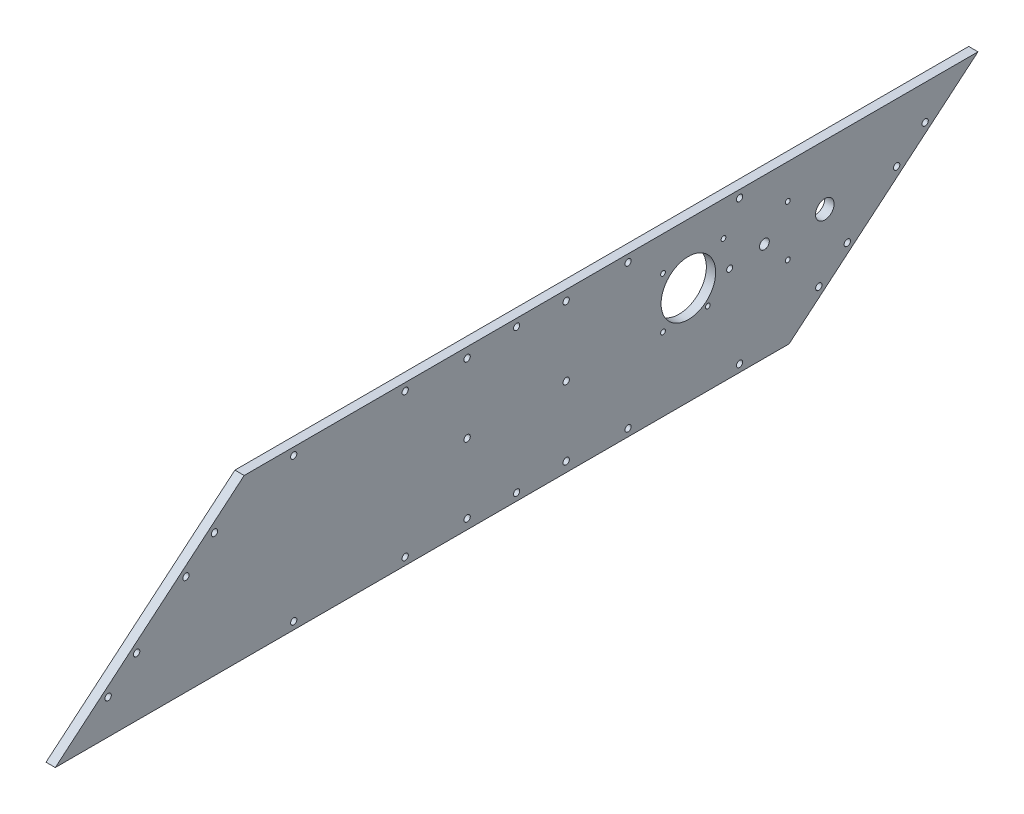
from build123d import *

# Parameters (mm, degrees)
BOSS_EXTRUDE1_DEPTH          = 4.7625
SKETCH2_R                    = 2.5
SKETCH2_R_2                  = 1.51
SKETCH2_R_3                  = 14
SKETCH2_R_4                  = 4.7625
GEARBOX_WITH_SLIP_FITS_DEPTH = 412.602247496
SKETCH5_R                    = 1.59385
CUT_EXTRUDE1_DEPTH           = 412.602247496
F_2_CLEARANCE_HOLE1_D        = 2.4384
F_4_CLEARANCE_HOLE2_D        = 3.2639
F_4_CLEARANCE_HOLE1_D        = 3.2639
F_4_CLEARANCE_HOLE1_DEPTH    = 4.826
F_4_CLEARANCE_HOLE1_TIP      = 0.980574487


with BuildPart() as part:
    # Sketch1 → Boss-Extrude1 (new body)
    with BuildSketch(Plane(origin=(0, 0, 0), x_dir=(0, 0, -1), z_dir=(1, 0, 0))):
        Polygon((33.297595377, -40.64), (312.697595377, -40.64), (345.995190754, -12.7), (409.563327383, 40.64), (312.697595377, 40.64), (33.297595377, 40.64), (0, 12.7), (-63.568136629, -40.64), align=None)
    extrude(amount=BOSS_EXTRUDE1_DEPTH)

    # Sketch2 → Gearbox (with Slip fits) (cut, through all)
    with BuildSketch(Plane(origin=(4.7625, 0, 0), x_dir=(0, 0, -1), z_dir=(1, 0, 0))):
        with Locations((300.047997385, 10.000000066)):
            Circle(SKETCH2_R)
        with Locations((282.21469668, 8.000000066)):
            Circle(SKETCH2_R_2)
        with Locations((261.047997385, 10.000000066)):
            Circle(SKETCH2_R_3)
        with Locations((331.004197385, 10.000000066)):
            Circle(SKETCH2_R_4)
    extrude(amount=-GEARBOX_WITH_SLIP_FITS_DEPTH, mode=Mode.SUBTRACT)

    # Sketch5 → Cut-Extrude1 (cut, through all)
    with BuildSketch(Plane(origin=(4.7625, 0, 0), x_dir=(0, 0, -1), z_dir=(1, 0, 0))):
        with Locations((287.297595377, 36.83)):
            Circle(SKETCH5_R)
        with Locations((230.147595377, 36.83)):
            Circle(SKETCH5_R)
        with Locations((172.997595377, 36.83)):
            Circle(SKETCH5_R)
        with Locations((115.847595377, 36.83)):
            Circle(SKETCH5_R)
        with Locations((58.697595377, 36.83)):
            Circle(SKETCH5_R)
        with Locations((58.697595377, -36.83)):
            Circle(SKETCH5_R)
        with Locations((115.847595377, -36.83)):
            Circle(SKETCH5_R)
        with Locations((172.997595377, -36.83)):
            Circle(SKETCH5_R)
        with Locations((230.147595377, -36.83)):
            Circle(SKETCH5_R)
        with Locations((287.297595377, -36.83)):
            Circle(SKETCH5_R)
    extrude(amount=-CUT_EXTRUDE1_DEPTH, mode=Mode.SUBTRACT)

    # #2 Clearance Hole1 (through all)
    with Locations(Plane(origin=(4.7625, 0, 0), x_dir=(0, 0, -1), z_dir=(1, 0, 0))):
        with Locations((248.047997385, 23.000000066), (279.047997385, 23.000000066), (271.047997455, -2.999999934), (248.047997385, -2.999999934), (312.047997385, 23.000000066), (312.047997385, -2.999999934)):
            Hole(F_2_CLEARANCE_HOLE1_D / 2)

    # #4 Clearance Hole2 (through all)
    with Locations(Plane(origin=(4.7625, 0, 0), x_dir=(0, 0, -1), z_dir=(1, 0, 0))):
        with Locations((147.597595377, 35.56), (198.397595377, 35.56), (198.397595377, -35.56), (147.597595377, -35.56), (147.597595377, 0), (198.397595377, 0)):
            Hole(F_4_CLEARANCE_HOLE2_D / 2)

    # #4 Clearance Hole1
    with Locations(Plane(origin=(4.7625, 0, 0), x_dir=(0, 0, -1), z_dir=(1, 0, 0))):
        with Locations((327.962613202, -22.8575274), (342.555759844, -10.612423436), (367.850547356, 10.612423436), (382.443693997, 22.8575274), (-36.448503243, -22.8575274), (-21.855356602, -10.612423436), (3.43943091, 10.612423436), (18.032577552, 22.8575274)):
            Hole(F_4_CLEARANCE_HOLE1_D / 2, depth=F_4_CLEARANCE_HOLE1_DEPTH)
            with Locations((0, 0, -(F_4_CLEARANCE_HOLE1_DEPTH + F_4_CLEARANCE_HOLE1_TIP / 2))):  # 118° drill point
                Cone(0, F_4_CLEARANCE_HOLE1_D / 2, F_4_CLEARANCE_HOLE1_TIP, mode=Mode.SUBTRACT)


solid = part.part
